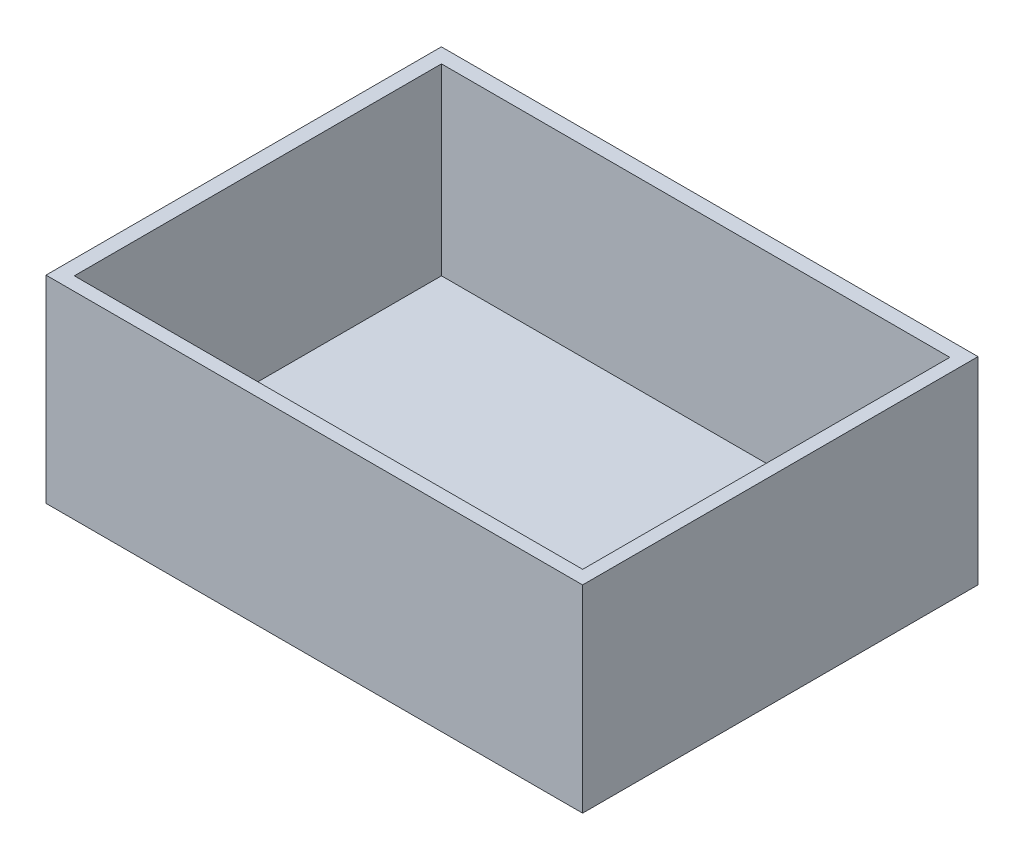
from build123d import *

# Parameters (mm, degrees)
SKETCH2_W           = 190
SKETCH2_H           = 140
BOSS_EXTRUDE1_DEPTH = 70
SKETCH3_W           = 180
SKETCH3_H           = 130
CUT_EXTRUDE1_DEPTH  = 65


with BuildPart() as part:
    # Sketch2 → Boss-Extrude1 (new body)
    with BuildSketch(Plane(origin=(0, 0, 0), x_dir=(1, 0, 0), z_dir=(0, 1, 0))):
        with Locations((33.210526316, -8.105263158)):
            Rectangle(SKETCH2_W, SKETCH2_H)
    extrude(amount=BOSS_EXTRUDE1_DEPTH)

    # Sketch3 → Cut-Extrude1 (cut)
    with BuildSketch(Plane(origin=(0, 70, 0), x_dir=(1, 0, 0), z_dir=(0, 1, 0))):
        with Locations((33.445418874, -8.311499386)):
            Rectangle(SKETCH3_W, SKETCH3_H)
    extrude(amount=-CUT_EXTRUDE1_DEPTH, mode=Mode.SUBTRACT)


solid = part.part
